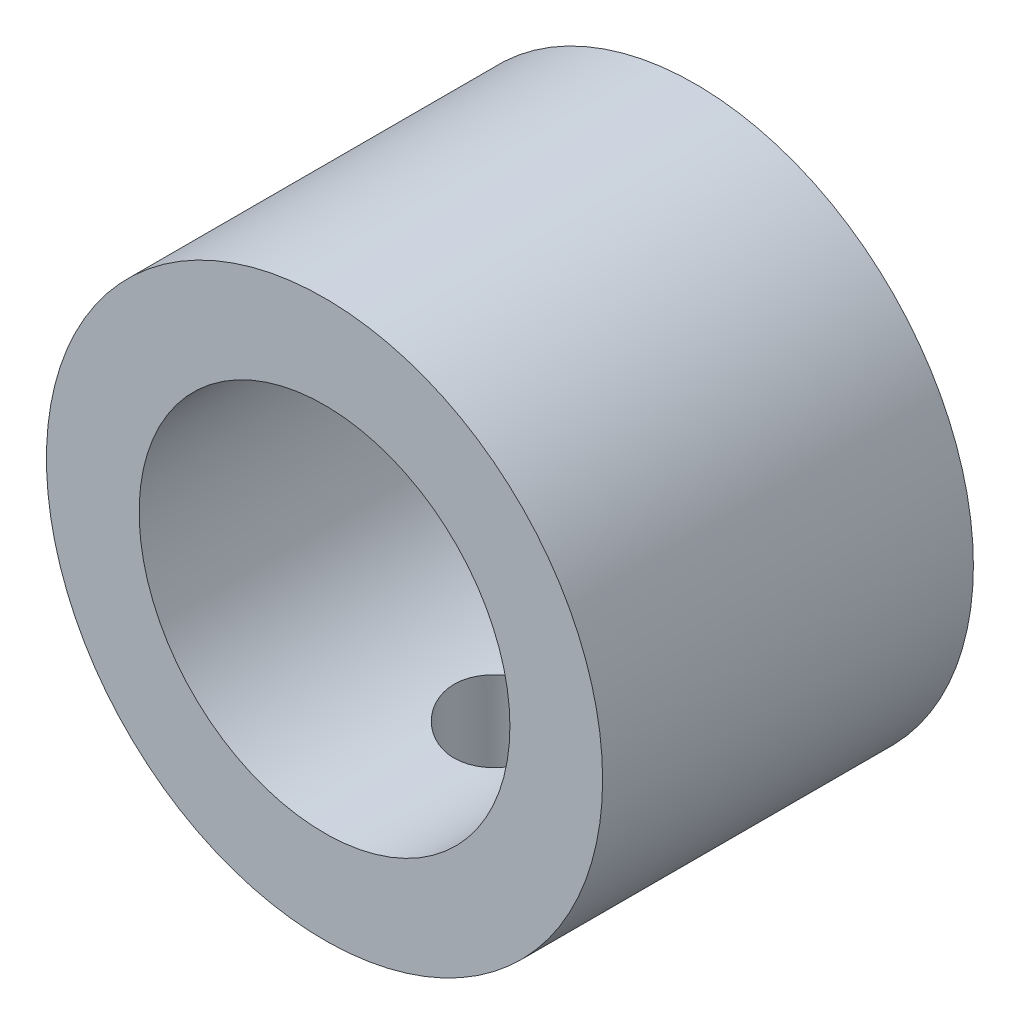
from build123d import *

# Parameters (mm, degrees)
SKETCH1_R               = 7.5
SKETCH1_R_2             = 5
BOSS_EXTRUDE1_DEPTH     = 5
CUT_EXTRUDE1_REACH      = 13.726
CUT_EXTRUDE1_END_RADIUS = 7.5
SKETCH2_R               = 1.5


with BuildPart() as part:
    # Sketch1 → Boss-Extrude1 (new, symmetric)
    with BuildSketch(Plane.XY):
        Circle(SKETCH1_R)
        Circle(SKETCH1_R_2, mode=Mode.SUBTRACT)
    extrude(amount=BOSS_EXTRUDE1_DEPTH, both=True)

    # Cut-Extrude1: up to this cylinder (the profile starts inside it)
    cut_extrude1_end = Plane(origin=(0, 0, 0), z_dir=(0, 0, -1)) * Cylinder(CUT_EXTRUDE1_END_RADIUS, 43.452, mode=Mode.PRIVATE)
    # Sketch2 → Cut-Extrude1 (cut, up to the surface)
    with BuildSketch(Plane(origin=(0, 0, 0), x_dir=(1, 0, 0), z_dir=(0, 1, 0)), mode=Mode.PRIVATE) as cut_extrude1_sk1:
        with Locations(Location((0, 0, 0), (0, 0, 270))):
            Circle(SKETCH2_R)
    cut_extrude1_tool1 = extrude(cut_extrude1_sk1.sketch, amount=-CUT_EXTRUDE1_REACH, mode=Mode.PRIVATE) & cut_extrude1_end
    add(cut_extrude1_tool1.solids().sort_by_distance((0, 0, 0))[0], mode=Mode.SUBTRACT)


solid = part.part
